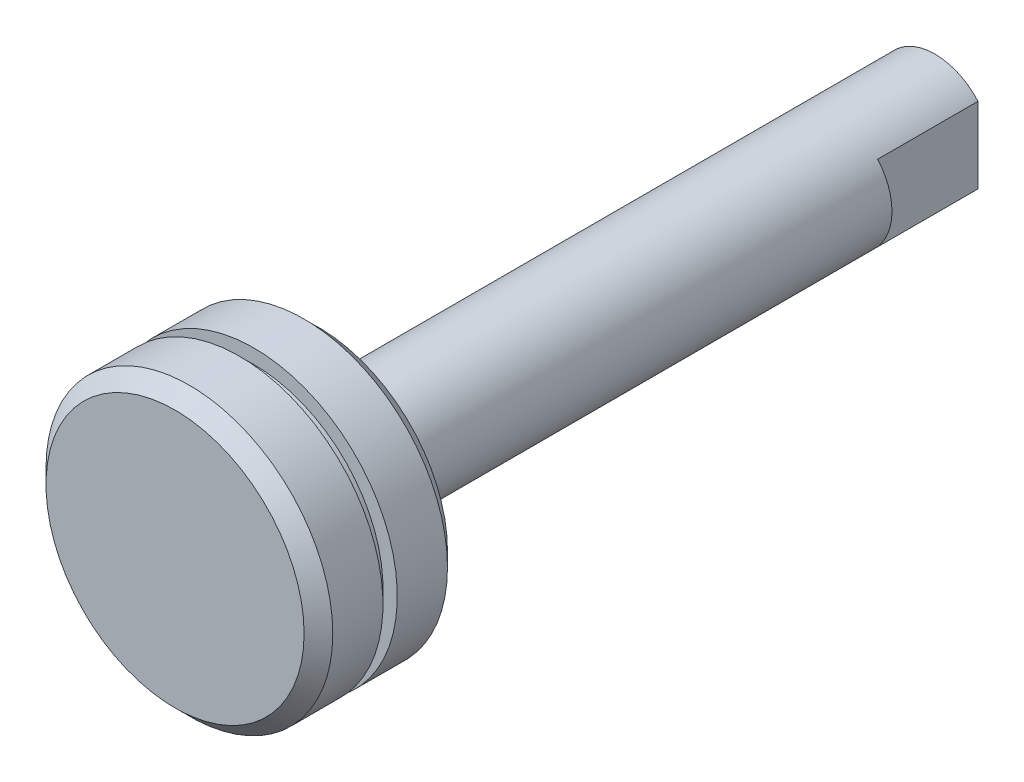
from build123d import *

# Parameters (mm, degrees)
ESQUISSE1_R               = 4
BASE_EXTRUSION_DEPTH      = 43
ESQUISSE2_R               = 10
BOSS_EXTRU_1_DEPTH        = 10
ESQUISSE4_W               = 3.314228255
ESQUISSE4_H               = 8.012066365
ESQUISSE4_W_2             = 3.056812469
ESQUISSE4_H_2             = 8.269482152
ENL_V_MAT_EXTRU_1_DEPTH   = 7
CHANFREIN2_SIZE           = 1
ESQUISSE6_W               = 1
ESQUISSE6_H               = 1
TROU_TARAUD_M5X0_81_D     = 4.2
TROU_TARAUD_M5X0_81_DEPTH = 19
TROU_TARAUD_M5X0_81_TIP   = 1.2618073
ESQUISSE10_R              = 7.5
ESQUISSE10_R_2            = 6.5
ENL_V_MAT_EXTRU_2_DEPTH   = 2


with BuildPart() as part:
    # Esquisse1 → Base-Extrusion (new body)
    with BuildSketch(Plane.XY):
        Circle(ESQUISSE1_R)
    extrude(amount=BASE_EXTRUSION_DEPTH)

    # Esquisse2 → Boss.-Extru.1 (add)
    with BuildSketch(Plane.XY.offset(43)):
        Circle(ESQUISSE2_R)
    extrude(amount=BOSS_EXTRU_1_DEPTH)

    # Esquisse4 → Enlèv. mat.-Extru.1 (cut)
    with BuildSketch(Plane(origin=(0, 0, 0), x_dir=(-1, 0, 0), z_dir=(0, 0, -1))):
        with Locations((4.657114127, 0.096530921)):
            Rectangle(ESQUISSE4_W, ESQUISSE4_H)
        with Locations((-4.528406235, -0.032176973)):
            Rectangle(ESQUISSE4_W_2, ESQUISSE4_H_2)
    extrude(amount=-ENL_V_MAT_EXTRU_1_DEPTH, mode=Mode.SUBTRACT)

    # Chanfrein2
    chanfrein2_edges = [part.edges().sort_by_distance(p)[0] for p in [
        (-10, 0, 43),
        (-10, 0, 53),
    ]]
    chamfer(chanfrein2_edges, length=CHANFREIN2_SIZE)

    # Esquisse6 → Enlèvement de matière-Révolution2 (revolve, cut)
    with BuildSketch(Plane(origin=(0, 0, 0), x_dir=(0, 0, -1), z_dir=(1, 0, 0)), mode=Mode.PRIVATE) as enl_vement_de_mati_re_r_volution2_sk:
        with Locations((-48, 9.5)):
            Rectangle(ESQUISSE6_W, ESQUISSE6_H)
    revolve(enl_vement_de_mati_re_r_volution2_sk.sketch.rotate(Axis((0, 0, 53), (0, 0, 1)), 90), axis=Axis((0, 0, 53), (0, 0, 1)), mode=Mode.SUBTRACT)

    # Trou taraudé M5x0.81
    with Locations(Plane(origin=(0, 0, 0), x_dir=(-1, 0, 0), z_dir=(0, 0, -1))):
        with Locations((0, 0)):
            Hole(TROU_TARAUD_M5X0_81_D / 2, depth=TROU_TARAUD_M5X0_81_DEPTH)
            with Locations((0, 0, -(TROU_TARAUD_M5X0_81_DEPTH + TROU_TARAUD_M5X0_81_TIP / 2))):  # 118° drill point
                Cone(0, TROU_TARAUD_M5X0_81_D / 2, TROU_TARAUD_M5X0_81_TIP, mode=Mode.SUBTRACT)

    # Esquisse10 → Enlèv. mat.-Extru.2 (cut)
    with BuildSketch(Plane(origin=(0, 0, 43), x_dir=(-1, 0, 0), z_dir=(0, 0, -1))):
        Circle(ESQUISSE10_R)
        Circle(ESQUISSE10_R_2, mode=Mode.SUBTRACT)
    extrude(amount=-ENL_V_MAT_EXTRU_2_DEPTH, mode=Mode.SUBTRACT)


solid = part.part
